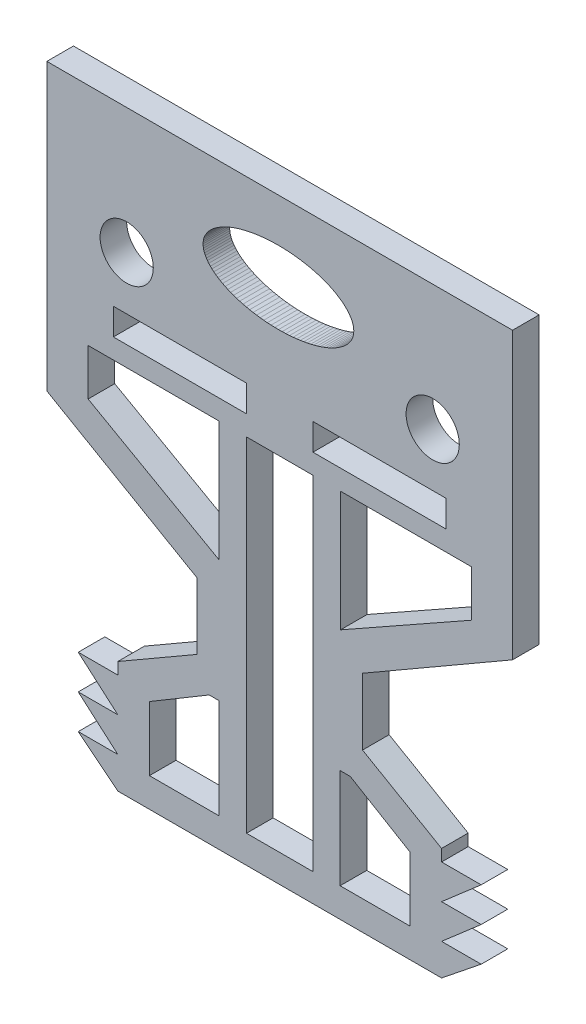
from build123d import *

# Parameters (mm, degrees)
MODEL_R         = 2
MODEL_W         = 10
MODEL_H         = 2
MODEL_W_2       = 4.987831099
MODEL_H_2       = 25.799348384
EXTRUDE_1_DEPTH = 2


with BuildPart() as part:
    # Model → 凸台-拉伸1 (new body)
    with BuildSketch(Plane.XY):
        Polygon((794.826364885, 604.086609439), (759.826364885, 604.086609439), (759.826364885, 582.631162925), (771.100956458, 576.121774445), (771.100956458, 571.121774445), (765.159330178, 567.691374913), (765.159330178, 566.808009524), (762.184594735, 566.808009524), (765.159330178, 564.224720814), (762.184594735, 564.224720814), (765.159330178, 561.641432105), (762.184594735, 561.641432105), (765.159330178, 559.256659904), (789.493399591, 559.256659904), (792.468135034, 561.641432105), (789.493399591, 561.641432105), (792.468135034, 564.224720814), (789.493399591, 564.224720814), (792.468135034, 566.808009524), (789.493399591, 566.808009524), (789.493399591, 567.691374913), (783.551773312, 571.121774445), (783.551773312, 576.121774445), (794.826364885, 582.631162925), align=None)
        with Locations((765.826364885, 594.647306527)):
            Circle(MODEL_R, mode=Mode.SUBTRACT)
        with Locations((788.826364885, 594.647306527)):
            Circle(MODEL_R, mode=Mode.SUBTRACT)
        with Locations((784.826364885, 589.647718545)):
            Rectangle(MODEL_W, MODEL_H, mode=Mode.SUBTRACT)
        with Locations((769.826364885, 589.647718545)):
            Rectangle(MODEL_W, MODEL_H, mode=Mode.SUBTRACT)
        Polygon((791.725011171, 587.146217285), (781.894706262, 587.146217285), (781.894706262, 578.118128773), (791.725011171, 583.659501515), align=None, mode=Mode.SUBTRACT)
        with Locations((777.326364885, 574.246543093)):
            Rectangle(MODEL_W_2, MODEL_H_2, mode=Mode.SUBTRACT)
        Polygon((787.11688102, 566.27157462), (782.629496351, 568.945406022), (781.869533608, 568.945406022), (781.869533608, 561.448894487), (787.11688102, 561.448894487), align=None, mode=Mode.SUBTRACT)
        Polygon((762.927718599, 587.146217285), (772.758023508, 587.146217285), (772.758023508, 578.118128773), (762.927718599, 583.659501515), align=None, mode=Mode.SUBTRACT)
        Polygon((767.53584875, 566.27157462), (772.023233419, 568.945406022), (772.783196161, 568.945406022), (772.783196161, 561.448894487), (767.53584875, 561.448894487), align=None, mode=Mode.SUBTRACT)
        Polygon((782.896259254, 598.074237023), (782.886259254, 598.208237023), (782.866259254, 598.343237023), (782.836259254, 598.476237023), (782.786259254, 598.608237023), (782.726259254, 598.740237023), (782.646259254, 598.869237023), (782.566259254, 598.997237023), (782.466259254, 599.122237023), (782.346259254, 599.245237023), (782.226259254, 599.365237023), (782.086259254, 599.483237023), (781.936259254, 599.596237023), (781.776259254, 599.706237023), (781.606259254, 599.812237023), (781.426259254, 599.914237023), (781.236259254, 600.011237023), (781.036259254, 600.104237023), (780.826259254, 600.192237023), (780.606259254, 600.275237023), (780.376259254, 600.352237023), (780.146259254, 600.424237023), (779.896259254, 600.490237023), (779.656259254, 600.551237023), (779.396259254, 600.605237023), (779.136259254, 600.654237023), (778.876259254, 600.696237023), (778.606259254, 600.732237023), (778.336259254, 600.761237023), (778.066259254, 600.784237023), (777.786259254, 600.801237023), (777.506259254, 600.810237023), (777.236259254, 600.814237023), (776.956259254, 600.810237023), (776.676259254, 600.801237023), (776.396259254, 600.784237023), (776.126259254, 600.761237023), (775.856259254, 600.732237023), (775.586259254, 600.696237023), (775.326259254, 600.654237023), (775.066259254, 600.605237023), (774.806259254, 600.551237023), (774.566259254, 600.490237023), (774.316259254, 600.424237023), (774.086259254, 600.352237023), (773.856259254, 600.275237023), (773.636259254, 600.192237023), (773.426259254, 600.104237023), (773.226259254, 600.011237023), (773.036259254, 599.914237023), (772.856259254, 599.812237023), (772.686259254, 599.706237023), (772.526259254, 599.596237023), (772.376259254, 599.483237023), (772.236259254, 599.365237023), (772.116259254, 599.245237023), (771.996259254, 599.122237023), (771.896259254, 598.997237023), (771.816259254, 598.869237023), (771.736259254, 598.740237023), (771.676259254, 598.608237023), (771.626259254, 598.476237023), (771.596259254, 598.343237023), (771.576259254, 598.208237023), (771.566259254, 598.074237023), (771.576259254, 597.940237023), (771.596259254, 597.805237023), (771.626259254, 597.672237023), (771.676259254, 597.540237023), (771.736259254, 597.408237023), (771.816259254, 597.279237023), (771.896259254, 597.151237023), (771.996259254, 597.026237023), (772.116259254, 596.903237023), (772.236259254, 596.783237023), (772.376259254, 596.666237023), (772.526259254, 596.552237023), (772.686259254, 596.442237023), (772.856259254, 596.336237023), (773.036259254, 596.234237023), (773.226259254, 596.137237023), (773.426259254, 596.044237023), (773.636259254, 595.956237023), (773.856259254, 595.873237023), (774.086259254, 595.796237023), (774.316259254, 595.724237023), (774.566259254, 595.658237023), (774.806259254, 595.597237023), (775.066259254, 595.543237023), (775.326259254, 595.494237023), (775.586259254, 595.452237023), (775.856259254, 595.416237023), (776.126259254, 595.387237023), (776.396259254, 595.364237023), (776.676259254, 595.347237023), (776.956259254, 595.338237023), (777.236259254, 595.334237023), (777.506259254, 595.338237023), (777.786259254, 595.347237023), (778.066259254, 595.364237023), (778.336259254, 595.387237023), (778.606259254, 595.416237023), (778.876259254, 595.452237023), (779.136259254, 595.494237023), (779.396259254, 595.543237023), (779.656259254, 595.597237023), (779.896259254, 595.658237023), (780.146259254, 595.724237023), (780.376259254, 595.796237023), (780.606259254, 595.873237023), (780.826259254, 595.956237023), (781.036259254, 596.044237023), (781.236259254, 596.137237023), (781.426259254, 596.234237023), (781.606259254, 596.336237023), (781.776259254, 596.442237023), (781.936259254, 596.552237023), (782.086259254, 596.666237023), (782.226259254, 596.783237023), (782.346259254, 596.903237023), (782.466259254, 597.026237023), (782.566259254, 597.151237023), (782.646259254, 597.279237023), (782.726259254, 597.408237023), (782.786259254, 597.540237023), (782.836259254, 597.672237023), (782.866259254, 597.805237023), (782.886259254, 597.940237023), align=None, mode=Mode.SUBTRACT)
    extrude(amount=EXTRUDE_1_DEPTH)


solid = part.part
